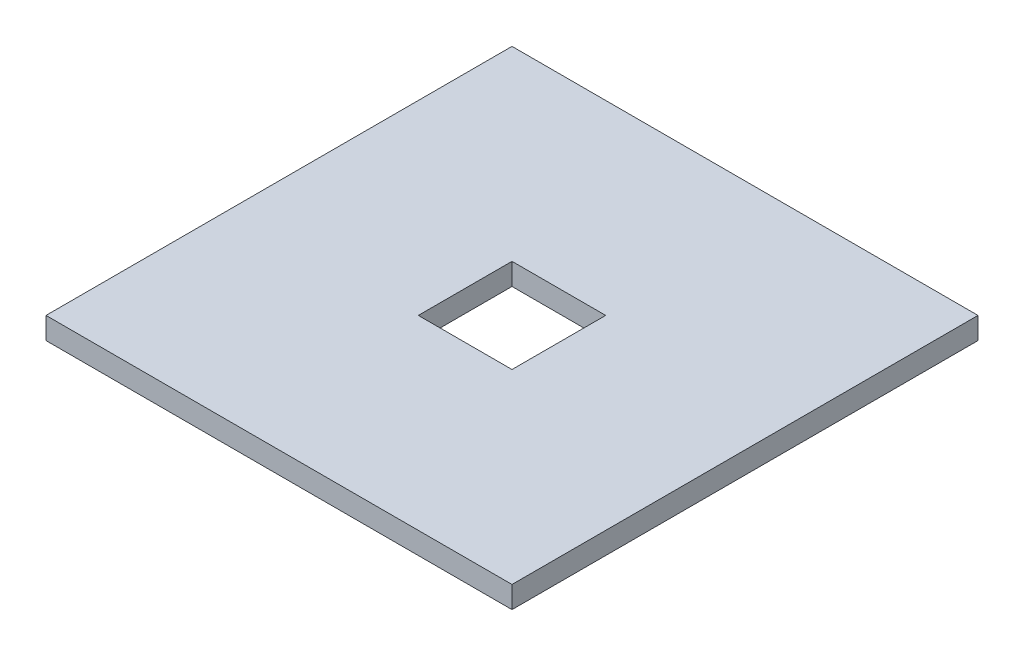
from build123d import *

# Parameters (mm, degrees)
SKETCH1_W           = 298.45
SKETCH1_H           = 298.45
BOSS_EXTRUDE1_DEPTH = 13.97
SKETCH3_W           = 60
SKETCH3_H           = 60
CUT_EXTRUDE2_DEPTH  = 212.497901053


with BuildPart() as part:
    # Sketch1 → Boss-Extrude1 (new body)
    with BuildSketch(Plane(origin=(0, 0, 0), x_dir=(1, 0, 0), z_dir=(0, 1, 0))):
        Rectangle(SKETCH1_W, SKETCH1_H)
    extrude(amount=BOSS_EXTRUDE1_DEPTH)

    # Sketch3 → Cut-Extrude2 (cut, through all)
    with BuildSketch(Plane(origin=(0, 13.97, 0), x_dir=(1, 0, 0), z_dir=(0, 1, 0))):
        Rectangle(SKETCH3_W, SKETCH3_H)
    extrude(amount=-CUT_EXTRUDE2_DEPTH, mode=Mode.SUBTRACT)


solid = part.part
